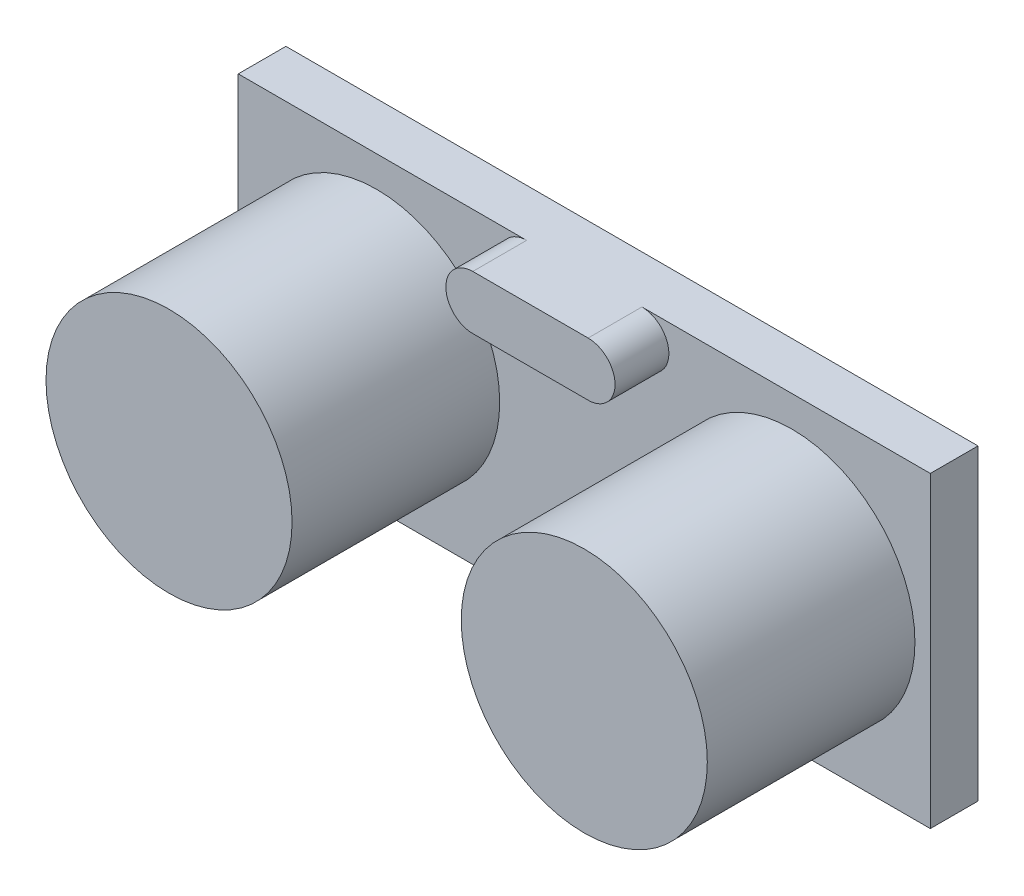
from build123d import *

# Parameters (mm, degrees)
SCHIZZO1_W                   = 45
SCHIZZO1_H                   = 20
ESTRUSIONE_ESTRUSIONE1_DEPTH = 3.1
SCHIZZO2_R                   = 8
ESTRUSIONE_ESTRUSIONE2_DEPTH = 13.5
SCHIZZO3_W                   = 7.5
SCHIZZO3_H                   = 3
ESTRUSIONE_ESTRUSIONE3_DEPTH = 4
ESTRUSIONE_ESTRUSIONE4_DEPTH = 3.5
SCHIZZO5_W                   = 7.5
SCHIZZO5_H                   = 2.5
ESTRUSIONE_ESTRUSIONE5_DEPTH = 7


with BuildPart() as part:
    # Schizzo1 → Estrusione-Estrusione1 (new body)
    with BuildSketch(Plane.XY):
        with Locations((22.5, 10)):
            Rectangle(SCHIZZO1_W, SCHIZZO1_H)
    extrude(amount=ESTRUSIONE_ESTRUSIONE1_DEPTH)

    # Schizzo2 → Estrusione-Estrusione2 (add)
    with BuildSketch(Plane.XY.offset(3.1)):
        with Locations(Location((9, 10, 0), (0, 0, 180))):
            Circle(SCHIZZO2_R)
        with Locations(Location((36, 10, 0), (0, 0, 180))):
            Circle(SCHIZZO2_R)
    extrude(amount=ESTRUSIONE_ESTRUSIONE2_DEPTH)

    # Schizzo3 → Estrusione-Estrusione3 (add)
    with BuildSketch(Plane(origin=(0, 0, 0), x_dir=(-1, 0, 0), z_dir=(0, 0, -1))):
        with Locations((-22.5, 1.5)):
            Rectangle(SCHIZZO3_W, SCHIZZO3_H)
    extrude(amount=ESTRUSIONE_ESTRUSIONE3_DEPTH)

    # Schizzo4 → Estrusione-Estrusione4 (add)
    with BuildSketch(Plane.XY.offset(3.1)):
        with BuildLine():
            Line((18.75, 20), (26.25, 20))
            ThreePointArc((26.25, 20), (28, 18.25), (26.25, 16.5))
            Line((26.25, 16.5), (18.75, 16.5))
            ThreePointArc((18.75, 16.5), (17, 18.25), (18.75, 20))
        make_face()
    extrude(amount=ESTRUSIONE_ESTRUSIONE4_DEPTH)

    # Schizzo5 → Estrusione-Estrusione5 (add)
    with BuildSketch(Plane.XZ):
        with Locations((22.5, -2.75)):
            Rectangle(SCHIZZO5_W, SCHIZZO5_H)
    extrude(amount=ESTRUSIONE_ESTRUSIONE5_DEPTH)


solid = part.part
